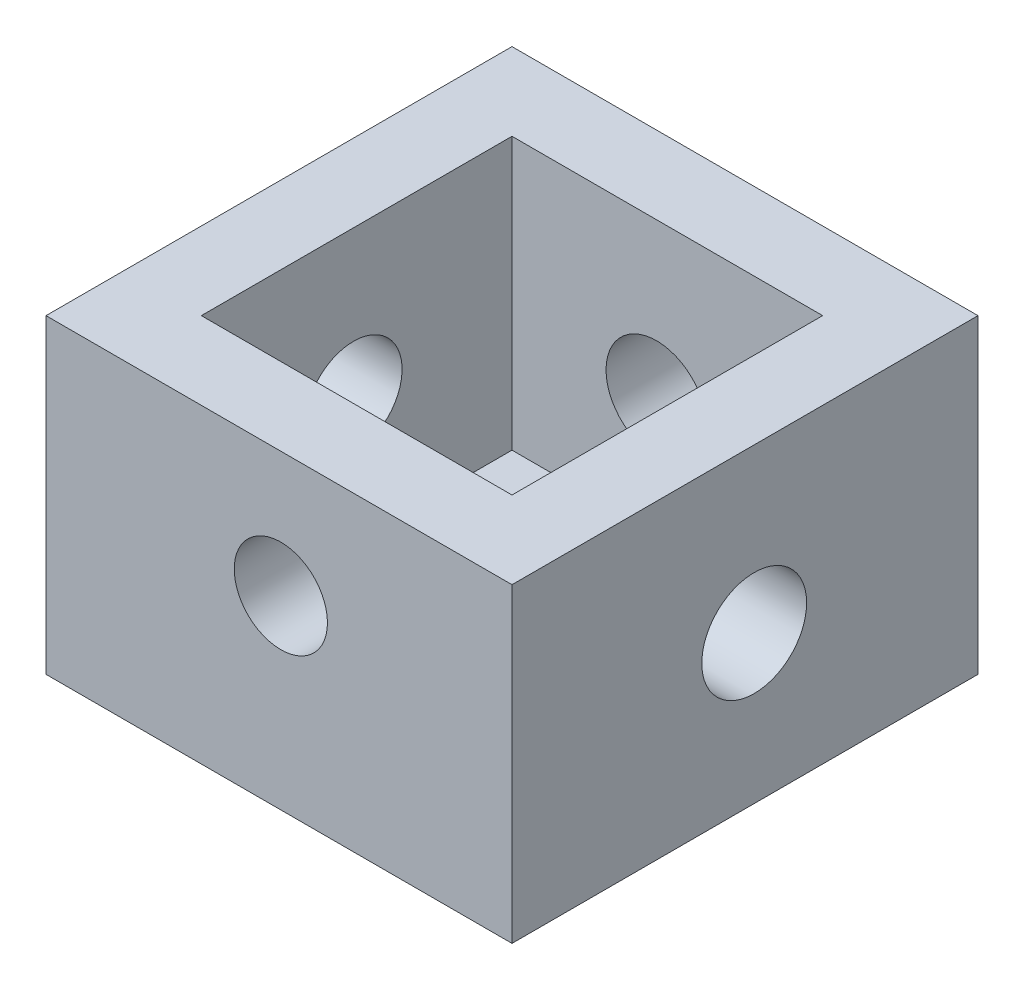
from build123d import *

# Parameters (mm, degrees)
SKETCH_1_W                    = 60
SKETCH_1_H                    = 60
EXTRUDE_2_DEPTH               = 40
SKETCH_2_W                    = 40
SKETCH_2_H                    = 40
CUT_EXTRUDE_1_DEPTH           = 35
HOLE_WIZARD_12_0_12_1_D       = 12
HOLE_WIZARD_12_0_12_1_DEPTH   = 10
HOLE_WIZARD_13_5_13_5_1_D     = 13.5
HOLE_WIZARD_13_5_13_5_1_DEPTH = 10
HOLE_WIZARD_12_5_12_5_1_D     = 12.5
HOLE_WIZARD_12_5_12_5_1_DEPTH = 10
HOLE_WIZARD_13_0_13_1_D       = 13
HOLE_WIZARD_13_0_13_1_DEPTH   = 10


with BuildPart() as part:
    # 草圖1 → 填料-伸長2 (new body)
    with BuildSketch(Plane(origin=(0, 0, 0), x_dir=(1, 0, 0), z_dir=(0, 1, 0))):
        with Locations((-17.631578947, 47.236842105)):
            Rectangle(SKETCH_1_W, SKETCH_1_H)
    extrude(amount=EXTRUDE_2_DEPTH)

    # 草圖2 → 除料-伸長1 (cut)
    with BuildSketch(Plane(origin=(0, 40, 0), x_dir=(1, 0, 0), z_dir=(0, 1, 0))):
        with Locations((-17.631578947, 47.236842105)):
            Rectangle(SKETCH_2_W, SKETCH_2_H)
    extrude(amount=-CUT_EXTRUDE_1_DEPTH, mode=Mode.SUBTRACT)

    # Ø12.0 (12) 直徑孔1
    with Locations(Plane(origin=(-17.39385665, 23.867389925, -17.236842105), x_dir=(1, 0, 0), z_dir=(0, 0, 1))):
        with Locations((0, 0)):
            Hole(HOLE_WIZARD_12_0_12_1_D / 2, depth=HOLE_WIZARD_12_0_12_1_DEPTH)

    # Ø13.5 (13.5) 直徑孔1
    with Locations(Plane(origin=(12.368421053, 19.014409134, -48.421566687), x_dir=(0, 0, 1), z_dir=(1, 0, 0))):
        with Locations((0, 0)):
            Hole(HOLE_WIZARD_13_5_13_5_1_D / 2, depth=HOLE_WIZARD_13_5_13_5_1_DEPTH)

    # Ø12.5 (12.5) 直徑孔1
    with Locations(Plane(origin=(-47.631578947, 21.093271668, -46.835113177), x_dir=(0, 0, -1), z_dir=(-1, 0, 0))):
        with Locations((0, 0)):
            Hole(HOLE_WIZARD_12_5_12_5_1_D / 2, depth=HOLE_WIZARD_12_5_12_5_1_DEPTH)

    # Ø13.0 (13) 直徑孔1
    with Locations(Plane(origin=(-19.022665384, 20.011822427, -77.236842105), x_dir=(-1, 0, 0), z_dir=(0, 0, -1))):
        with Locations((0, 0)):
            Hole(HOLE_WIZARD_13_0_13_1_D / 2, depth=HOLE_WIZARD_13_0_13_1_DEPTH)


solid = part.part
